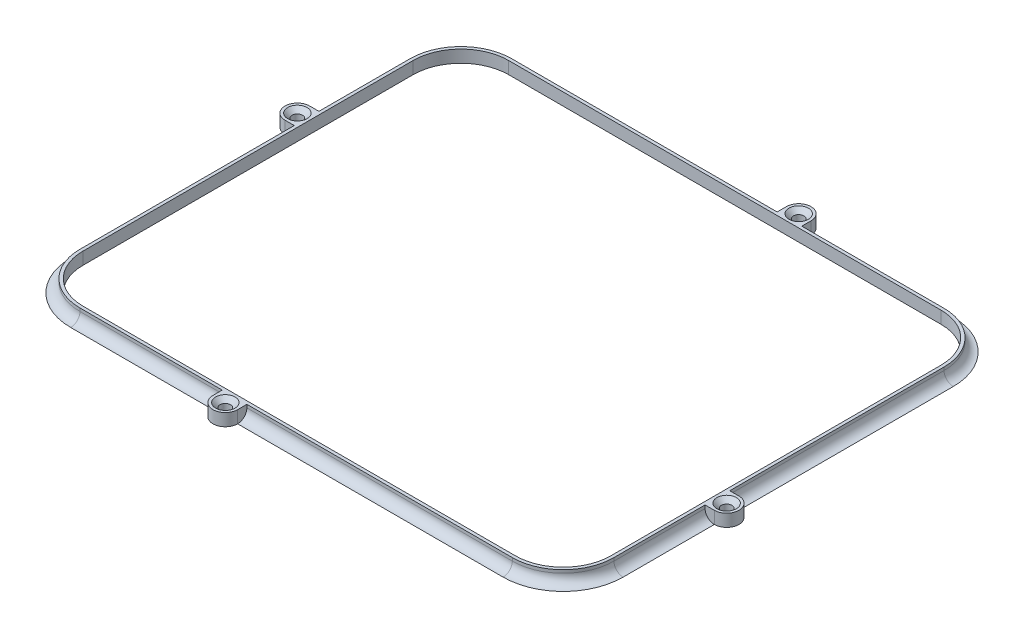
from build123d import *

# Parameters (mm, degrees)
BOSS_EXTRUDE1_DEPTH                             = 4
SKETCH2_R                                       = 1.6
BOSS_EXTRUDE2_DEPTH                             = 4
CSK_FOR_M3_FLAT_HEAD_MACHINE_SCREW1_D           = 3.4
CSK_FOR_M3_FLAT_HEAD_MACHINE_SCREW1_CSINK_D     = 6.3
CSK_FOR_M3_FLAT_HEAD_MACHINE_SCREW1_CSINK_ANGLE = 90


with BuildPart() as part:
    # Sketch1 → Boss-Extrude1 (new body)
    with BuildSketch(Plane(origin=(0, 0, 0), x_dir=(1, 0, 0), z_dir=(0, 1, 0))):
        with BuildLine():
            Line((86.7, -53.6), (86.7, 53.6))
            ThreePointArc((86.7, 53.6), (81.86726189, 65.26726189), (70.2, 70.1))
            Line((70.2, 70.1), (-70.2, 70.1))
            ThreePointArc((-70.2, 70.1), (-81.86726189, 65.26726189), (-86.7, 53.6))
            Line((-86.7, 53.6), (-86.7, -53.6))
            ThreePointArc((-86.7, -53.6), (-81.86726189, -65.26726189), (-70.2, -70.1))
            Line((-70.2, -70.1), (70.2, -70.1))
            ThreePointArc((70.2, -70.1), (81.86726189, -65.26726189), (86.7, -53.6))
        make_face()
        with BuildLine():
            Line((-70.2, -69.1), (70.2, -69.1))
            ThreePointArc((70.2, -69.1), (81.160155108, -64.560155108), (85.7, -53.6))
            Line((85.7, -53.6), (85.7, 53.6))
            ThreePointArc((85.7, 53.6), (81.160155108, 64.560155108), (70.2, 69.1))
            Line((70.2, 69.1), (-70.2, 69.1))
            ThreePointArc((-70.2, 69.1), (-81.160155108, 64.560155108), (-85.7, 53.6))
            Line((-85.7, 53.6), (-85.7, -53.6))
            ThreePointArc((-85.7, -53.6), (-81.160155108, -64.560155108), (-70.2, -69.1))
        make_face(mode=Mode.SUBTRACT)
    extrude(amount=BOSS_EXTRUDE1_DEPTH)

    # Sweep1: sweep along a path in Sketch5
    with BuildLine(Plane.XZ) as sweep1_path:
        Line((86.7, 53.6), (86.7, -53.6))
        ThreePointArc((86.7, -53.6), (81.86726189, -65.26726189), (70.2, -70.1))
        Line((70.2, -70.1), (-70.2, -70.1))
        ThreePointArc((-70.2, -70.1), (-81.86726189, -65.26726189), (-86.7, -53.6))
        Line((-86.7, -53.6), (-86.7, 53.6))
        ThreePointArc((-86.7, 53.6), (-81.86726189, 65.26726189), (-70.2, 70.1))
        Line((-70.2, 70.1), (70.2, 70.1))
        ThreePointArc((70.2, 70.1), (81.86726189, 65.26726189), (86.7, 53.6))
    # Sketch4 → Sweep1 (sweep)
    with BuildSketch(Plane.XY):
        with BuildLine():
            Line((-86.7, 0), (-89.7, 0))
            ThreePointArc((-89.7, 0), (-87.578679656, 0.878679656), (-86.7, 3))
            Line((-86.7, 3), (-86.7, 0))
        make_face()
    sweep(path=sweep1_path.line)

    # Sketch2 → Boss-Extrude2 (add, through all)
    # profile 1 of 4: a face of its own
    with BuildSketch(Plane(origin=(0, 0, 0), x_dir=(1, 0, 0), z_dir=(0, 1, 0))):
        with BuildLine():
            Line((-86.7, 24), (-89.7, 24))
            ThreePointArc((-89.7, 24), (-93.7, 20), (-89.7, 16))
            Line((-89.7, 16), (-86.7, 16))
            Line((-86.7, 16), (-86.7, 24))
        make_face()
        with Locations(Location((-89.7, 20, 0), (0, 0, 270))):
            Circle(SKETCH2_R, mode=Mode.SUBTRACT)
    # profile 2 of 4: a face of its own
    with BuildSketch(Plane(origin=(0, 0, 0), x_dir=(1, 0, 0), z_dir=(0, 1, 0))):
        with BuildLine():
            Line((16, 70.1), (16, 73.1))
            ThreePointArc((16, 73.1), (20, 77.1), (24, 73.1))
            Line((24, 73.1), (24, 70.1))
            Line((24, 70.1), (16, 70.1))
        make_face()
        with Locations((20, 73.1)):
            Circle(SKETCH2_R, mode=Mode.SUBTRACT)
    # profile 3 of 4: a face of its own
    with BuildSketch(Plane(origin=(0, 0, 0), x_dir=(1, 0, 0), z_dir=(0, 1, 0))):
        with BuildLine():
            Line((-24, -70.1), (-24, -73.1))
            ThreePointArc((-24, -73.1), (-20, -77.1), (-16, -73.1))
            Line((-16, -73.1), (-16, -70.1))
            Line((-16, -70.1), (-24, -70.1))
        make_face()
        with Locations(Location((-20, -73.1, 0), (0, 0, 180))):
            Circle(SKETCH2_R, mode=Mode.SUBTRACT)
    # profile 4 of 4: a face of its own
    with BuildSketch(Plane(origin=(0, 0, 0), x_dir=(1, 0, 0), z_dir=(0, 1, 0))):
        with BuildLine():
            Line((86.7, -24), (89.7, -24))
            ThreePointArc((89.7, -24), (93.7, -20), (89.7, -16))
            Line((89.7, -16), (86.7, -16))
            Line((86.7, -16), (86.7, -24))
        make_face()
        with Locations(Location((89.7, -20, 0), (0, 0, 270))):
            Circle(SKETCH2_R, mode=Mode.SUBTRACT)
    extrude(amount=BOSS_EXTRUDE2_DEPTH)

    # CSK for M3 Flat Head Machine Screw1 (through all)
    with Locations(Plane(origin=(20, 4, -73.1), x_dir=(0, 0, 1), z_dir=(0, 1, 0))):
        with Locations((0, 0), (53.1, -109.7), (93.1, 69.7), (146.2, -40)):
            CounterSinkHole(CSK_FOR_M3_FLAT_HEAD_MACHINE_SCREW1_D / 2, CSK_FOR_M3_FLAT_HEAD_MACHINE_SCREW1_CSINK_D / 2, counter_sink_angle=CSK_FOR_M3_FLAT_HEAD_MACHINE_SCREW1_CSINK_ANGLE)


solid = part.part
